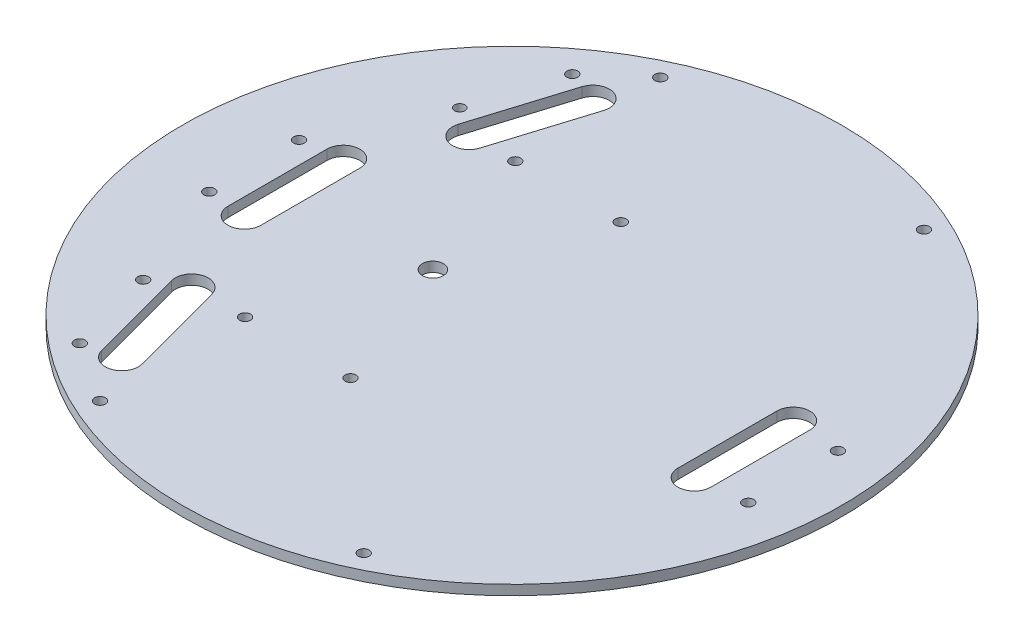
from build123d import *

# Parameters (mm, degrees)
CROQUIS1_R              = 100
CROQUIS1_R_2            = 1.65
CROQUIS1_R_3            = 3.175
CROQUIS1_R_4            = 1.559752628
SALIENTE_EXTRUIR1_DEPTH = 3


with BuildPart() as part:
    # Croquis1 → Saliente-Extruir1 (new body)
    with BuildSketch(Plane(origin=(0, 0, 0), x_dir=(1, 0, 0), z_dir=(0, 1, 0))):
        with Locations(Location((0, 0, 0), (0, 0, 270))):
            Circle(CROQUIS1_R)
        with Locations(Location((40, -85, 0), (0, 0, 270))):
            Circle(CROQUIS1_R_2, mode=Mode.SUBTRACT)
        with Locations(Location((40, 85, 0), (0, 0, 90))):
            Circle(CROQUIS1_R_2, mode=Mode.SUBTRACT)
        with Locations(Location((-40, -85, 0), (0, 0, 90))):
            Circle(CROQUIS1_R_2, mode=Mode.SUBTRACT)
        with Locations(Location((-40, 85, 0), (0, 0, 270))):
            Circle(CROQUIS1_R_2, mode=Mode.SUBTRACT)
        with Locations(Location((-40, 41, 0), (0, 0, 270))):
            Circle(CROQUIS1_R_2, mode=Mode.SUBTRACT)
        with Locations(Location((-40, -41, 0), (0, 0, 270))):
            Circle(CROQUIS1_R_2, mode=Mode.SUBTRACT)
        with Locations(Location((-24, 0, 0), (0, 0, 270))):
            Circle(CROQUIS1_R_3, mode=Mode.SUBTRACT)
        with Locations(Location((-8, 41, 0), (0, 0, 270))):
            Circle(CROQUIS1_R_2, mode=Mode.SUBTRACT)
        with Locations(Location((-8, -41, 0), (0, 0, 270))):
            Circle(CROQUIS1_R_2, mode=Mode.SUBTRACT)
        with Locations(Location((85.070235004, 13.824441517, 0), (0, 0, 270))):
            Circle(CROQUIS1_R_2, mode=Mode.SUBTRACT)
        with Locations(Location((85.070235004, -13.375558483, 0), (0, 0, 270))):
            Circle(CROQUIS1_R_2, mode=Mode.SUBTRACT)
        with Locations(Location((-54.227480628, 72.528357265, 0), (0, 0, 270))):
            Circle(CROQUIS1_R_2, mode=Mode.SUBTRACT)
        with Locations(Location((-62.456735614, 46.603092322, 0), (0, 0, 270))):
            Circle(CROQUIS1_R_4, mode=Mode.SUBTRACT)
        with Locations(Location((-78.396993978, 13.752324836, 0), (0, 0, 270))):
            Circle(CROQUIS1_R_2, mode=Mode.SUBTRACT)
        with Locations(Location((-78.396993978, -13.447675164, 0), (0, 0, 270))):
            Circle(CROQUIS1_R_2, mode=Mode.SUBTRACT)
        with Locations(Location((-65.278300678, -46.636121303, 0), (0, 0, 270))):
            Circle(CROQUIS1_R_2, mode=Mode.SUBTRACT)
        with Locations(Location((-58.238422651, -72.909303778, 0), (0, 0, 270))):
            Circle(CROQUIS1_R_2, mode=Mode.SUBTRACT)
        with BuildLine():
            Line((-51.095611493, -39.959459006), (-43.33104014, -68.937233795))
            ThreePointArc((-43.33104014, -68.937233795), (-46.866574046, -75.060958152), (-52.990298403, -71.525424246))
            Line((-52.990298403, -71.525424246), (-60.754869756, -42.547649457))
            ThreePointArc((-60.754869756, -42.547649457), (-57.21933585, -36.4239251), (-51.095611493, -39.959459006))
        make_face(mode=Mode.SUBTRACT)
        with BuildLine():
            Line((-61.754274717, 15.577653458), (-61.754274717, -14.422346542))
            ThreePointArc((-61.754274717, -14.422346542), (-66.754274717, -19.422346542), (-71.754274717, -14.422346542))
            Line((-71.754274717, -14.422346542), (-71.754274717, 15.577653458))
            ThreePointArc((-71.754274717, 15.577653458), (-66.754274717, 20.577653458), (-61.754274717, 15.577653458))
        make_face(mode=Mode.SUBTRACT)
        with BuildLine():
            Line((-39.917801293, 67.733415285), (-48.810516369, 39.081720421))
            ThreePointArc((-48.810516369, 39.081720421), (-55.067918025, 35.788557123), (-58.361081323, 42.04595878))
            Line((-58.361081323, 42.04595878), (-49.468366247, 70.697653644))
            ThreePointArc((-49.468366247, 70.697653644), (-43.210964591, 73.990816942), (-39.917801293, 67.733415285))
        make_face(mode=Mode.SUBTRACT)
        with BuildLine():
            Line((75.337806397, 15.02279383), (75.337806397, -14.97720617))
            ThreePointArc((75.337806397, -14.97720617), (70.337806397, -19.97720617), (65.337806397, -14.97720617))
            Line((65.337806397, -14.97720617), (65.337806397, 15.02279383))
            ThreePointArc((65.337806397, 15.02279383), (70.337806397, 20.02279383), (75.337806397, 15.02279383))
        make_face(mode=Mode.SUBTRACT)
    extrude(amount=SALIENTE_EXTRUIR1_DEPTH)


solid = part.part
